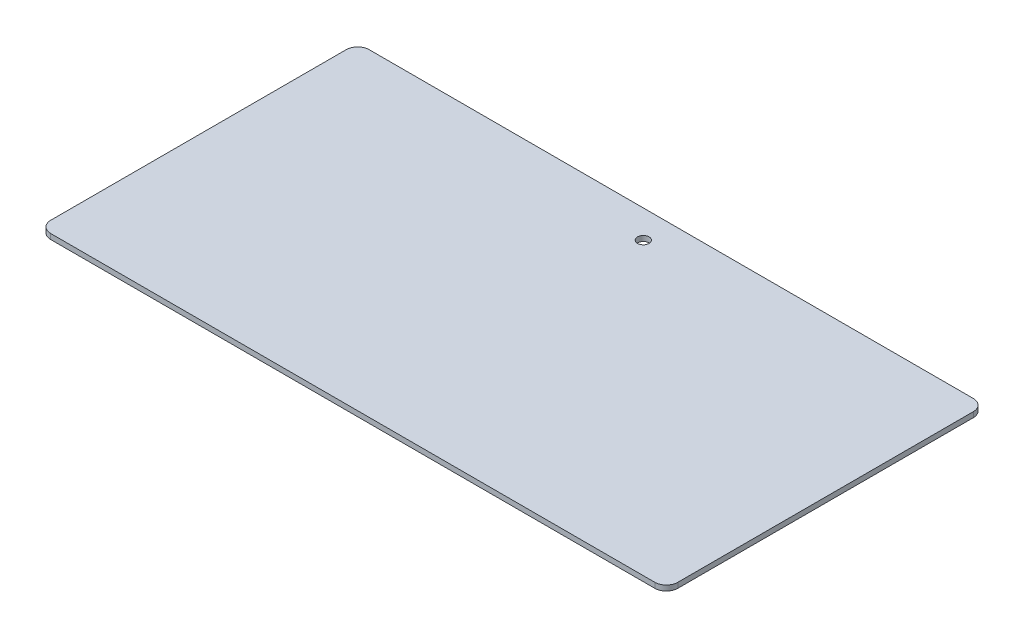
from build123d import *

# Parameters (mm, degrees)
SKETCH_1_W          = 191
SKETCH_1_H          = 97
EXTRUDE_2_DEPTH     = 1.6
FILLET_1_R          = 3.5
SKETCH_3_R          = 1.75
CUT_EXTRUDE_1_DEPTH = 250.108231932


with BuildPart() as part:
    # 草图1 → 凸台-拉伸2 (new body)
    with BuildSketch(Plane(origin=(0, 0, 0), x_dir=(1, 0, 0), z_dir=(0, 1, 0))):
        with Locations((133.941389502, 48.5)):
            Rectangle(SKETCH_1_W, SKETCH_1_H)
    extrude(amount=EXTRUDE_2_DEPTH)

    # 圆角1
    fillet_1_edges = [part.edges().sort_by_distance(p)[0] for p in [
        (38.441389502, 0.8, 0),
        (38.441389502, 0.8, -97),
        (229.441389502, 0.8, -97),
        (229.441389502, 0.8, 0),
    ]]
    fillet(fillet_1_edges, radius=FILLET_1_R)

    # 草图3 → 切除-拉伸1 (cut, through all)
    with BuildSketch(Plane(origin=(0, 1.6, 0), x_dir=(1, 0, 0), z_dir=(0, 1, 0))):
        with Locations(Location((133.941389502, 88.5, 0), (0, 0, 270))):
            Circle(SKETCH_3_R)
    extrude(amount=-CUT_EXTRUDE_1_DEPTH, mode=Mode.SUBTRACT)


solid = part.part
